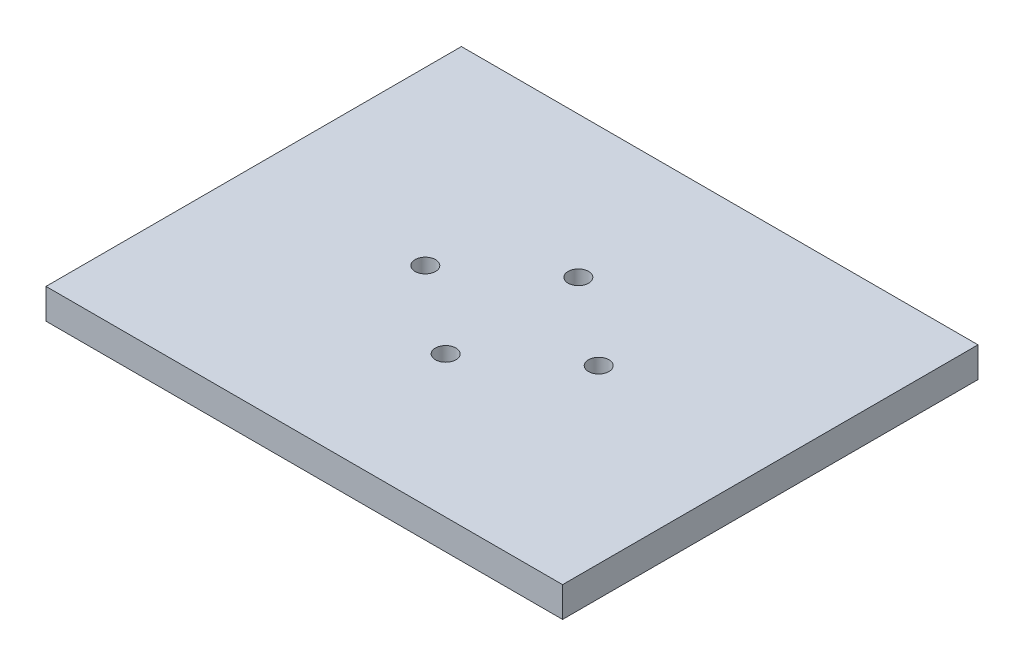
from build123d import *

# Parameters (mm, degrees)
SKETCH1_R           = 1.7
BOSS_EXTRUDE1_DEPTH = 5


with BuildPart() as part:
    # Sketch1 → Boss-Extrude1 (new body)
    with BuildSketch(Plane(origin=(0, 0, 0), x_dir=(1, 0, 0), z_dir=(0, 1, 0))):
        Polygon((42.825, 26.738412941), (42.825, 34.437743191), (33.250510286, 34.437743191), (-33.250510286, 34.437743191), (-42.825, 34.437743191), (-42.825, 26.738412941), (-42.825, -26.738412941), (-42.825, -34.437743191), (-33.250510286, -34.437743191), (33.250510286, -34.437743191), (42.825, -34.437743191), (42.825, -26.738412941), align=None)
        with Locations(Location((0, 11, 0), (0, 0, 270))):
            Circle(SKETCH1_R, mode=Mode.SUBTRACT)
        with Locations(Location((-14.375, 0, 0), (0, 0, 270))):
            Circle(SKETCH1_R, mode=Mode.SUBTRACT)
        with Locations(Location((0, -11, 0), (0, 0, 90))):
            Circle(SKETCH1_R, mode=Mode.SUBTRACT)
        with Locations(Location((14.375, 0, 0), (0, 0, 90))):
            Circle(SKETCH1_R, mode=Mode.SUBTRACT)
    extrude(amount=BOSS_EXTRUDE1_DEPTH)


solid = part.part
